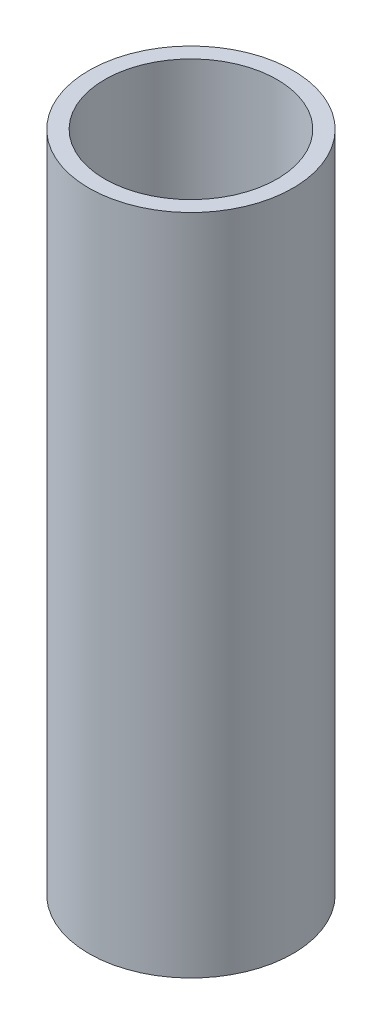
from build123d import *

# Parameters (mm, degrees)
SKETCH_1_R      = 10
SKETCH_1_R_2    = 8.45
EXTRUDE_1_DEPTH = 65


with BuildPart() as part:
    # Эскиз1 → Бобышка-Вытянуть1 (new body)
    with BuildSketch(Plane(origin=(0, 0, 0), x_dir=(1, 0, 0), z_dir=(0, 1, 0))):
        with Locations(Location((0, 0, 0), (0, 0, 270))):
            Circle(SKETCH_1_R)
        with Locations(Location((0, 0, 0), (0, 0, 270))):
            Circle(SKETCH_1_R_2, mode=Mode.SUBTRACT)
    extrude(amount=EXTRUDE_1_DEPTH)


solid = part.part
